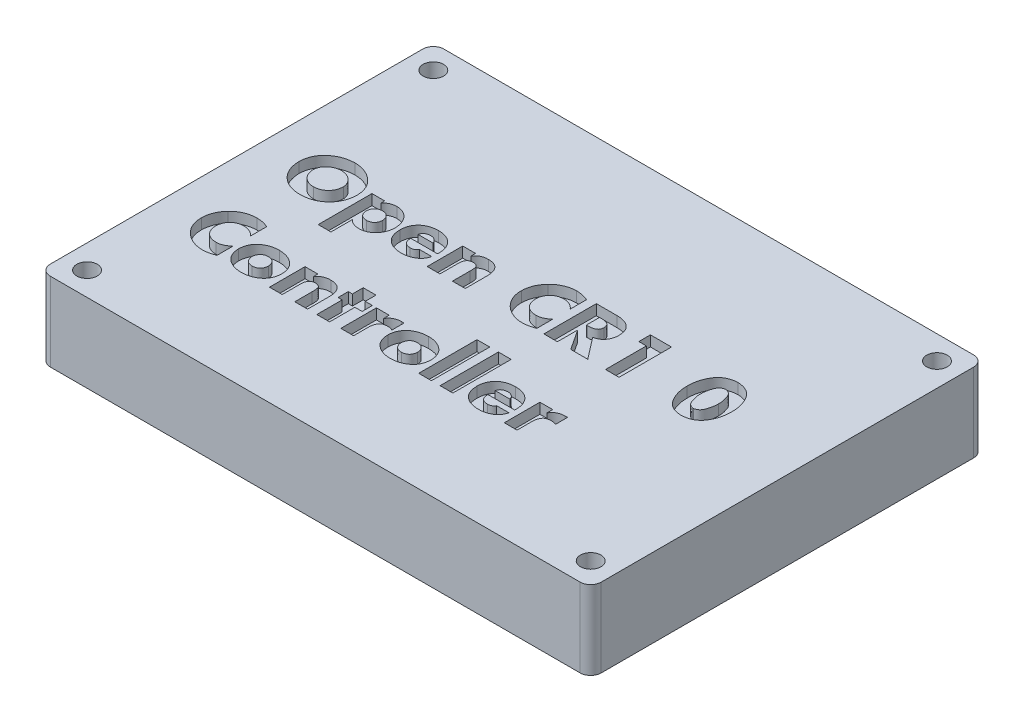
from build123d import *

# Parameters (mm, degrees)
SKETCH1_W              = 105
SKETCH1_H              = 75
BOSS_EXTRUDE1_DEPTH    = 15
M3_5_CLEARANCE_HOLE1_D = 3.9
SKETCH5_W              = 2.434314097
SKETCH5_H              = 11.112828439
CUT_EXTRUDE1_DEPTH     = 2
FILLET37_R             = 2


with BuildPart() as part:
    # Sketch1 → Boss-Extrude1 (new body)
    with BuildSketch(Plane(origin=(0, 0, 0), x_dir=(1, 0, 0), z_dir=(0, 1, 0))):
        Rectangle(SKETCH1_W, SKETCH1_H)
    extrude(amount=BOSS_EXTRUDE1_DEPTH)

    # M3.5 Clearance Hole1 (through all)
    with Locations(Plane(origin=(0, 15, 0), x_dir=(1, 0, 0), z_dir=(0, 1, 0))):
        with Locations((48, 33), (-48, 33), (-48, -33), (48, -33)):
            Hole(M3_5_CLEARANCE_HOLE1_D / 2)

    # Sketch5 → Cut-Extrude1 (cut)
    # profile 1 of 18: a face of its own
    with BuildSketch(Plane(origin=(0, 15, 0), x_dir=(1, 0, 0), z_dir=(0, 1, 0))):
        with BuildLine():
            add(Edge.make_bspline(
                [(-40.185459979, 10.243429334), (-40.370572928, 10.235709066), (-40.735143215, 10.2205044), (-41.270607726, 10.142344985), (-41.786210993, 10.027984963), (-42.281474501, 9.868513562), (-42.756753051, 9.66684576), (-43.212279103, 9.422838832), (-43.646948914, 9.134928108), (-44.057131478, 8.808288253), (-44.437719706, 8.451341468), (-44.769194208, 8.059730999), (-45.056167842, 7.644693482), (-45.292500939, 7.201690642), (-45.481040051, 6.733357083), (-45.619644575, 6.239737383), (-45.712778744, 5.720664917), (-45.733360464, 5.364887779), (-45.743851474, 5.183539413)],
                knots=[0, 0, 0, 0, 1.066914355, 2.10123212, 3.113067516, 4.107006638, 5.094636472, 6.08407704, 7.080306196, 8.094452311, 9.102347328, 10.081583564, 11.044964205, 12.004499658, 12.968487536, 13.948131457, 14.954112089, 16, 16, 16, 16], degree=3))
            add(Edge.make_bspline(
                [(-45.743851474, 5.183539413), (-45.735562012, 4.990079582), (-45.719330771, 4.611274183), (-45.639327567, 4.056719894), (-45.511783486, 3.530406752), (-45.339744339, 3.030319645), (-45.120361445, 2.558268431), (-44.854251472, 2.113444052), (-44.541281651, 1.696059665), (-44.184781539, 1.309559015), (-43.791473483, 0.957836368), (-43.364678416, 0.648727567), (-42.906855993, 0.387649721), (-42.420013053, 0.17179125), (-41.903446611, 0.001762764), (-41.357017758, -0.123286739), (-40.78087975, -0.203504354), (-40.3866891, -0.219706268), (-40.185505261, -0.22797527)],
                knots=[0, 0, 0, 0, 1.071176162, 2.097424104, 3.095011841, 4.064376378, 5.019536036, 5.970643985, 6.927982314, 7.901635748, 8.876032584, 9.843501619, 10.812545035, 11.787469732, 12.786075676, 13.817527939, 14.886127542, 16, 16, 16, 16], degree=3))
            add(Edge.make_bspline(
                [(-40.185505261, -0.22797527), (-39.984316099, -0.219744813), (-39.590752718, -0.20364451), (-39.015315272, -0.12306522), (-38.469480947, 0.001721238), (-37.952974725, 0.171878111), (-37.466436209, 0.387124152), (-37.009822392, 0.649248872), (-36.583285477, 0.958400677), (-36.188198608, 1.308885862), (-35.831732759, 1.696142568), (-35.518686718, 2.113425315), (-35.252527786, 2.558261745), (-35.033418199, 3.030365681), (-34.860358294, 3.530081461), (-34.736970293, 4.057227449), (-34.65227138, 4.610973366), (-34.63820463, 4.990021406), (-34.631023035, 5.183539413)],
                knots=[0, 0, 0, 0, 1.114185034, 2.179552935, 3.211294646, 4.210180819, 5.185379101, 6.151601439, 7.119341966, 8.096675446, 9.070602108, 10.028209086, 10.979583935, 11.935011632, 12.904648193, 13.901681209, 14.928730859, 16, 16, 16, 16], degree=3))
            add(Edge.make_bspline(
                [(-34.631023035, 5.183539413), (-34.641529151, 5.364881722), (-34.662140508, 5.720646979), (-34.755060759, 6.239805206), (-34.894381801, 6.732880834), (-35.079941875, 7.202147874), (-35.316939232, 7.644627519), (-35.603703373, 8.059749008), (-35.935235325, 8.451336463), (-36.31580762, 8.808289578), (-36.725994492, 9.134927919), (-37.160663211, 9.422838299), (-37.616189391, 9.66684806), (-38.091468506, 9.868504881), (-38.586729598, 10.028017867), (-39.102342196, 10.142218561), (-39.637081864, 10.220892731), (-40.001043464, 10.234568248), (-40.185505261, 10.241499227)],
                knots=[0, 0, 0, 0, 1.046239959, 2.052559205, 3.032532875, 3.995465432, 4.955323866, 5.919028783, 6.898594631, 7.906828906, 8.921316385, 9.917880873, 10.907654489, 11.89561676, 12.889890443, 13.902066425, 14.936732342, 16, 16, 16, 16], degree=3))
            Line((-40.185505261, 10.241499227), (-40.185459979, 10.243429334))
        make_face()
        with BuildLine():
            add(Edge.make_bspline(
                [(-40.185459979, 7.685467633), (-40.086830157, 7.67976608), (-39.893344647, 7.668581148), (-39.609293101, 7.628480137), (-39.338450641, 7.563472094), (-39.078298934, 7.481724104), (-38.831526036, 7.375044354), (-38.599442095, 7.243920673), (-38.377089791, 7.095091999), (-38.17069236, 6.92419892), (-37.982745637, 6.738441432), (-37.816833535, 6.54206101), (-37.675033605, 6.33633732), (-37.556114396, 6.121284168), (-37.463022439, 5.896294492), (-37.395638991, 5.662276969), (-37.34946075, 5.420314123), (-37.340390149, 5.255227366), (-37.33581438, 5.17194745)],
                knots=[0, 0, 0, 0, 1.130290503, 2.217329709, 3.277353109, 4.314482939, 5.334424864, 6.347286649, 7.361113167, 8.392466533, 9.40864743, 10.38149446, 11.330003386, 12.263418779, 13.188593609, 14.109797397, 15.046465523, 16, 16, 16, 16], degree=3))
            add(Edge.make_bspline(
                [(-37.33581438, 5.17194745), (-37.340303762, 5.069377476), (-37.349097315, 4.868469077), (-37.395083026, 4.575729302), (-37.462027065, 4.297285984), (-37.554764697, 4.033560261), (-37.673270255, 3.785221545), (-37.815596138, 3.551979858), (-37.980012361, 3.3321411), (-38.169459884, 3.130495555), (-38.376366078, 2.947793094), (-38.598757742, 2.789103231), (-38.830777202, 2.649860116), (-39.078194323, 2.538208421), (-39.337336747, 2.448388186), (-39.609633952, 2.386368473), (-39.892983252, 2.341250375), (-40.086792172, 2.333786258), (-40.185505261, 2.329984544)],
                knots=[0, 0, 0, 0, 1.098473526, 2.151629266, 3.166719768, 4.161133007, 5.138791705, 6.10726526, 7.082221388, 8.072538579, 9.064294906, 10.032547535, 10.993926311, 11.956589956, 12.933445969, 13.925202296, 14.943239095, 16, 16, 16, 16], degree=3))
            add(Edge.make_bspline(
                [(-40.185505261, 2.329984544), (-40.284214216, 2.333821702), (-40.478651922, 2.341380166), (-40.762680062, 2.386204786), (-41.035076592, 2.44805647), (-41.293356811, 2.538563546), (-41.540567044, 2.650362453), (-41.773902547, 2.788496959), (-41.996529631, 2.947871175), (-42.203495286, 3.130474445), (-42.392926823, 3.332146656), (-42.557347257, 3.55197839), (-42.699672023, 3.785221941), (-42.818177883, 4.033560152), (-42.910915432, 4.297286014), (-42.977859494, 4.575729293), (-43.023845199, 4.868469079), (-43.032638753, 5.069377477), (-43.037128135, 5.17194745)],
                knots=[0, 0, 0, 0, 1.056348917, 2.080804725, 3.072174406, 4.042133248, 5.00442159, 5.97136375, 6.939238898, 7.930608578, 8.920539684, 9.895115717, 10.863211703, 11.840489251, 12.834514808, 13.849209568, 14.901954725, 16, 16, 16, 16], degree=3))
            add(Edge.make_bspline(
                [(-43.037128135, 5.17194745), (-43.032552366, 5.255227366), (-43.023481764, 5.420314122), (-42.977303527, 5.662276976), (-42.909920063, 5.896294468), (-42.816828169, 6.121284256), (-42.69790872, 6.336336985), (-42.556109709, 6.542062296), (-42.390194028, 6.738436402), (-42.20226138, 6.924218733), (-41.995810504, 7.09501748), (-41.773186942, 7.244507453), (-41.539842028, 7.37455345), (-41.293264024, 7.48137771), (-41.033954226, 7.563831141), (-40.763013855, 7.628520937), (-40.478354124, 7.66894069), (-40.284158315, 7.678621488), (-40.185505261, 7.683539413)],
                knots=[0, 0, 0, 0, 0.95315381, 1.889448002, 2.81028403, 3.735089514, 4.668132271, 5.616262537, 6.588721189, 7.60449641, 8.635438042, 9.648859823, 10.66775563, 11.687290376, 12.716994241, 13.776594461, 14.870491853, 16, 16, 16, 16], degree=3))
            Line((-40.185505261, 7.683539413), (-40.185459979, 7.685467633))
        make_face(mode=Mode.SUBTRACT)
    # profile 2 of 18: a face of its own
    with BuildSketch(Plane(origin=(0, 15, 0), x_dir=(1, 0, 0), z_dir=(0, 1, 0))):
        with BuildLine():
            Line((-31.054902478, 6.792888376), (-33.489216575, 6.792888376))
            Line((-33.489216575, 6.792888376), (-33.489216575, -3.454404946))
            Line((-33.489216575, -3.454404946), (-31.054902478, -3.454404946))
            Line((-31.054902478, -3.454404946), (-31.054902478, 0.631969517))
            add(Edge.make_bspline(
                [(-31.054902478, 0.631969517), (-30.987873099, 0.560324968), (-30.854907098, 0.418203868), (-30.622696024, 0.241236644), (-30.374820122, 0.088707322), (-30.10808152, -0.031996722), (-29.828998367, -0.123693538), (-29.544212917, -0.192046613), (-29.2528083, -0.23138206), (-29.057335124, -0.236821971), (-28.958689186, -0.239567233)],
                knots=[0, 0, 0, 0, 1.005082862, 1.993780199, 2.984242437, 3.986645382, 4.989636189, 5.99456233, 6.987951778, 8, 8, 8, 8], degree=3))
            add(Edge.make_bspline(
                [(-28.958689186, -0.239567233), (-28.835463596, -0.233589395), (-28.594883177, -0.221918516), (-28.244226908, -0.164397395), (-27.912120949, -0.077742837), (-27.598174075, 0.039691485), (-27.304041847, 0.18961602), (-27.029814438, 0.37104461), (-26.7735623, 0.582377813), (-26.539198137, 0.823861053), (-26.327920735, 1.087720743), (-26.14083337, 1.368273655), (-25.984926826, 1.666429647), (-25.851256403, 1.977372476), (-25.752689267, 2.30664148), (-25.675925019, 2.649816934), (-25.629764521, 3.009483702), (-25.620859326, 3.254639199), (-25.616339882, 3.379057187)],
                knots=[0, 0, 0, 0, 1.07691445, 2.102522109, 3.097195217, 4.070953929, 5.024434895, 5.974591301, 6.937566446, 7.920124459, 8.908462463, 9.886695417, 10.860535366, 11.843672907, 12.838330109, 13.857888027, 14.912864434, 16, 16, 16, 16], degree=3))
            add(Edge.make_bspline(
                [(-25.616339882, 3.379057187), (-25.620570096, 3.503516982), (-25.628886553, 3.748200726), (-25.679102725, 4.107351148), (-25.753777468, 4.451881488), (-25.855816024, 4.78221401), (-25.98862747, 5.096539897), (-26.146960002, 5.396962231), (-26.334032183, 5.682688898), (-26.546234523, 5.951560374), (-26.783961603, 6.19661009), (-27.040056235, 6.414458647), (-27.318562691, 6.5974552), (-27.614023163, 6.75093634), (-27.930877267, 6.870561535), (-28.264905321, 6.962328981), (-28.619538046, 7.017767393), (-28.86190964, 7.031326262), (-28.9857371, 7.038253478)],
                knots=[0, 0, 0, 0, 1.078073293, 2.119455587, 3.135962978, 4.129307889, 5.109391313, 6.087583741, 7.066984285, 8.063644317, 9.049899711, 10.019849874, 10.969815296, 11.930367885, 12.897989272, 13.898031229, 14.926105778, 16, 16, 16, 16], degree=3))
            add(Edge.make_bspline(
                [(-28.9857371, 7.038253478), (-29.085760807, 7.036208697), (-29.284349622, 7.032148953), (-29.577993206, 6.982470831), (-29.865175064, 6.908056637), (-30.142302461, 6.802232304), (-30.405169012, 6.666711521), (-30.641408723, 6.492655054), (-30.854494876, 6.28839092), (-30.970848196, 6.129538683), (-31.029786559, 6.049072643)],
                knots=[0, 0, 0, 0, 1.014062275, 2.013336964, 3.013637032, 4.021085534, 5.017984993, 6.004958594, 6.989418824, 8, 8, 8, 8], degree=3))
            Line((-31.029786559, 6.049072643), (-31.054902478, 6.04965375))
            Line((-31.054902478, 6.04965375), (-31.054902478, 6.792888376))
        make_face()
        with BuildLine():
            add(Edge.make_bspline(
                [(-29.607833449, 4.953630262), (-29.547262259, 4.949747687), (-29.429617551, 4.942206735), (-29.258349919, 4.920858504), (-29.099256254, 4.880527521), (-28.948730852, 4.831688823), (-28.81023284, 4.765103212), (-28.681115411, 4.688097169), (-28.564269084, 4.595933543), (-28.458523156, 4.491844514), (-28.363992184, 4.377503728), (-28.280605712, 4.256216265), (-28.211242778, 4.127539196), (-28.151938011, 3.993673895), (-28.108568778, 3.852009004), (-28.074993893, 3.704919517), (-28.05581663, 3.550854866), (-28.052397877, 3.446082901), (-28.050652092, 3.392581144)],
                knots=[0, 0, 0, 0, 1.17879404, 2.289518822, 3.345083784, 4.361471533, 5.357261256, 6.322423568, 7.275600885, 8.239547066, 9.198694834, 10.152610254, 11.092818568, 12.033775158, 12.990964148, 13.964918075, 14.960786327, 16, 16, 16, 16], degree=3))
            add(Edge.make_bspline(
                [(-28.050652092, 3.392581144), (-28.052406953, 3.337793981), (-28.055844926, 3.230459657), (-28.074836083, 3.073158489), (-28.108298615, 2.924079493), (-28.151916774, 2.781802466), (-28.21140783, 2.648080324), (-28.279465368, 2.519776955), (-28.364846429, 2.401773981), (-28.457823675, 2.289309782), (-28.565025641, 2.189228039), (-28.681172005, 2.09900156), (-28.809859082, 2.02348437), (-28.949359323, 1.961733539), (-29.099241589, 1.913953771), (-29.258655461, 1.876713854), (-29.429437209, 1.853425345), (-29.547230352, 1.849173708), (-29.607839109, 1.84698609)],
                knots=[0, 0, 0, 0, 1.065420712, 2.087281133, 3.074576776, 4.03286587, 4.974903907, 5.916192809, 6.850628588, 7.801280481, 8.748959516, 9.695562723, 10.655404629, 11.641906051, 12.655525839, 13.709407358, 14.821408703, 16, 16, 16, 16], degree=3))
            add(Edge.make_bspline(
                [(-29.607839109, 1.84698609), (-29.668450857, 1.849158985), (-29.786249811, 1.853382007), (-29.957613457, 1.87695803), (-30.117768262, 1.913708159), (-30.267791702, 1.961322599), (-30.406298104, 2.023913564), (-30.534704051, 2.099561131), (-30.652449324, 2.188567229), (-30.759722139, 2.289392905), (-30.85278073, 2.401752108), (-30.9381403, 2.519782821), (-31.006203603, 2.648078747), (-31.065693104, 2.781802897), (-31.10931169, 2.924079373), (-31.142774103, 3.073158523), (-31.161765293, 3.230459648), (-31.165203261, 3.337793978), (-31.16695812, 3.392581144)],
                knots=[0, 0, 0, 0, 1.177800723, 2.289056161, 3.354423679, 4.367363551, 5.341782792, 6.300980856, 7.256909103, 8.203952454, 9.15396667, 10.087775649, 11.028433154, 11.969839292, 12.927485585, 13.914118971, 14.93529395, 16, 16, 16, 16], degree=3))
            add(Edge.make_bspline(
                [(-31.16695812, 3.392581144), (-31.165212337, 3.446082904), (-31.161793588, 3.550854874), (-31.142616294, 3.704919485), (-31.109041526, 3.852009121), (-31.065671866, 3.99367347), (-31.006368664, 4.127540753), (-30.936999883, 4.256210419), (-30.85363558, 4.377525953), (-30.759021041, 4.491760927), (-30.653225631, 4.596604442), (-30.534751327, 4.687537954), (-30.405906437, 4.764665199), (-30.268438057, 4.832102098), (-30.117758301, 4.880811016), (-29.957906405, 4.920490213), (-29.786146083, 4.942731046), (-29.66842766, 4.94865246), (-29.607839109, 4.951700155)],
                knots=[0, 0, 0, 0, 1.038570363, 2.033822138, 3.007173154, 3.96376961, 4.904143715, 5.843770008, 6.797094921, 7.755648943, 8.718998407, 9.681455618, 10.646020462, 11.629906577, 12.645665147, 13.712723228, 14.822760432, 16, 16, 16, 16], degree=3))
            Line((-29.607839109, 4.951700155), (-29.607833449, 4.953630262))
        make_face(mode=Mode.SUBTRACT)
    # profile 3 of 18: a face of its own
    with BuildSketch(Plane(origin=(0, 15, 0), x_dir=(1, 0, 0), z_dir=(0, 1, 0))):
        with BuildLine():
            add(Edge.make_bspline(
                [(-17.284929738, 3.342249309), (-17.288679496, 3.478950097), (-17.2960075, 3.746099074), (-17.344939316, 4.13670297), (-17.42452081, 4.505355998), (-17.528797478, 4.854295208), (-17.670036731, 5.178290154), (-17.83803231, 5.482271301), (-18.038825429, 5.763065351), (-18.266105101, 6.023436239), (-18.524242503, 6.254317001), (-18.806066766, 6.460787429), (-19.117202041, 6.630761463), (-19.451253597, 6.776399258), (-19.812480287, 6.884115479), (-20.197994023, 6.966297796), (-20.609305554, 7.01587273), (-20.892484588, 7.02556276), (-21.037514534, 7.030525502)],
                knots=[0, 0, 0, 0, 1.102782696, 2.155124876, 3.170070917, 4.142976072, 5.087828941, 6.01584772, 6.939916815, 7.867571937, 8.798262867, 9.72838806, 10.679618793, 11.652440709, 12.663162538, 13.714760587, 14.829616211, 16, 16, 16, 16], degree=3))
            add(Edge.make_bspline(
                [(-21.037514534, 7.030525502), (-21.176087328, 7.026038891), (-21.446906964, 7.017270486), (-21.842720682, 6.971522929), (-22.216488191, 6.893353418), (-22.571123426, 6.790193614), (-22.90354795, 6.653735366), (-23.217577589, 6.491976463), (-23.507629792, 6.296997382), (-23.777300417, 6.076962117), (-24.02034555, 5.830746287), (-24.232234627, 5.560028346), (-24.413544702, 5.268112225), (-24.562599664, 4.952976081), (-24.680518448, 4.616248891), (-24.764933665, 4.257443242), (-24.820039952, 3.877213099), (-24.830467649, 3.615595488), (-24.83581438, 3.481452859)],
                knots=[0, 0, 0, 0, 1.137689445, 2.223442528, 3.265294305, 4.268773578, 5.250351616, 6.210241881, 7.163164631, 8.11340075, 9.062798496, 9.996498222, 10.929404615, 11.877521311, 12.85214354, 13.85216426, 14.89871201, 16, 16, 16, 16], degree=3))
            add(Edge.make_bspline(
                [(-24.83581438, 3.481452859), (-24.830262307, 3.332451835), (-24.819473776, 3.042919969), (-24.757030402, 2.623755128), (-24.668802082, 2.231458431), (-24.542556948, 1.868120352), (-24.383359321, 1.533023693), (-24.191236624, 1.224827705), (-23.963988495, 0.945878179), (-23.705755237, 0.695881698), (-23.420767453, 0.47623875), (-23.115084742, 0.283841768), (-22.787806974, 0.124002427), (-22.442778805, -0.011107938), (-22.076045024, -0.11233856), (-21.690298899, -0.185380756), (-21.284600839, -0.230809511), (-21.007367091, -0.236603641), (-20.865567084, -0.239567233)],
                knots=[0, 0, 0, 0, 1.163066474, 2.260016722, 3.302588064, 4.297800306, 5.255671425, 6.192968005, 7.125669966, 8.057084086, 8.992221305, 9.929517885, 10.871493985, 11.831170557, 12.81791666, 13.836358061, 14.893336609, 16, 16, 16, 16], degree=3))
            add(Edge.make_bspline(
                [(-20.865567084, -0.239567233), (-20.766344722, -0.238194379), (-20.569505936, -0.235470891), (-20.27765437, -0.21030078), (-19.993164521, -0.165539569), (-19.715673037, -0.103533604), (-19.445216858, -0.024341241), (-19.181315771, 0.071910313), (-18.926269524, 0.18884746), (-18.679045549, 0.320889155), (-18.445359122, 0.472040873), (-18.231647252, 0.645548743), (-18.036680438, 0.83773321), (-17.863374078, 1.05073008), (-17.708636371, 1.282323493), (-17.5784424, 1.535238253), (-17.464471395, 1.806060573), (-17.408664525, 1.997042232), (-17.380250237, 2.094281298)],
                knots=[0, 0, 0, 0, 1.049201029, 2.081420473, 3.094773408, 4.092790319, 5.086335346, 6.073205057, 7.060732588, 8.051097814, 9.035284723, 9.998968218, 10.957342387, 11.925324256, 12.898133995, 13.897335386, 14.929420008, 16, 16, 16, 16], degree=3))
            Line((-17.380250237, 2.094281298), (-19.715385507, 2.094281298))
            add(Edge.make_bspline(
                [(-19.715385507, 2.094281298), (-19.749219752, 2.043830935), (-19.814837079, 1.945988702), (-19.930763327, 1.816150893), (-20.058555015, 1.707106705), (-20.200007289, 1.619017857), (-20.352823397, 1.551212565), (-20.518099346, 1.504991507), (-20.694571316, 1.476920434), (-20.816515001, 1.476340746), (-20.879091041, 1.476043277)],
                knots=[0, 0, 0, 0, 1.051326352, 2.038917281, 3.004525721, 3.951721342, 4.915652817, 5.890241468, 6.917366374, 8, 8, 8, 8], degree=3))
            add(Edge.make_bspline(
                [(-20.879091041, 1.476043277), (-20.940345429, 1.478300641), (-21.058703259, 1.482662397), (-21.230393162, 1.504786047), (-21.390653019, 1.535921783), (-21.538958719, 1.583659942), (-21.676149361, 1.640465777), (-21.801884697, 1.711253548), (-21.915750554, 1.793814787), (-22.017798575, 1.889824395), (-22.106619396, 1.998757207), (-22.184255097, 2.119347283), (-22.250517344, 2.252065213), (-22.304066186, 2.397348035), (-22.346585433, 2.555108437), (-22.377550783, 2.725007693), (-22.393937219, 2.907339311), (-22.397656511, 3.03255805), (-22.399570176, 3.09698609)],
                knots=[0, 0, 0, 0, 1.158879783, 2.239227257, 3.271313107, 4.242201573, 5.181154615, 6.075672522, 6.965032745, 7.835418892, 8.718247618, 9.617068503, 10.543211434, 11.51844633, 12.540925798, 13.630505717, 14.780838457, 16, 16, 16, 16], degree=3))
            Line((-22.399570176, 3.09698609), (-17.284929738, 3.098916197))
            Line((-17.284929738, 3.098916197), (-17.284929738, 3.342249309))
        make_face()
        with BuildLine():
            add(Edge.make_bspline(
                [(-22.359507718, 4.443585781), (-22.337229449, 4.522655971), (-22.294027907, 4.675987198), (-22.18026882, 4.883061919), (-22.033669547, 5.060827438), (-21.851284356, 5.203168322), (-21.645113539, 5.315249959), (-21.419156271, 5.396753697), (-21.17419924, 5.445851414), (-21.004900657, 5.452517999), (-20.917730917, 5.455950541)],
                knots=[0, 0, 0, 0, 1.028318465, 1.99409322, 2.941113281, 3.901834164, 4.878575192, 5.875839621, 6.906296173, 8, 8, 8, 8], degree=3))
            add(Edge.make_bspline(
                [(-20.917730917, 5.455950541), (-20.835662082, 5.452006936), (-20.675611013, 5.444316098), (-20.443152491, 5.390702194), (-20.227661464, 5.302359693), (-20.027587276, 5.185878401), (-19.853986362, 5.036913458), (-19.710276421, 4.863504713), (-19.602381618, 4.66381472), (-19.562513072, 4.518037463), (-19.542151319, 4.443585781)],
                knots=[0, 0, 0, 0, 1.066545448, 2.07998246, 3.082746843, 4.084951881, 5.076575458, 6.040274496, 6.999124657, 8, 8, 8, 8], degree=3))
            Line((-19.542151319, 4.443585781), (-22.359507718, 4.443585781))
        make_face(mode=Mode.SUBTRACT)
    # profile 4 of 18: a face of its own
    with BuildSketch(Plane(origin=(0, 15, 0), x_dir=(1, 0, 0), z_dir=(0, 1, 0))):
        with BuildLine():
            Line((-13.744237873, 6.789748886), (-16.17855197, 6.789748886))
            Line((-16.17855197, 6.789748886), (-16.17855197, 0.007726089))
            Line((-16.17855197, 0.007726089), (-13.744237873, 0.007726089))
            Line((-13.744237873, 0.007726089), (-13.744237873, 3.512253444))
            add(Edge.make_bspline(
                [(-13.744237873, 3.512253444), (-13.743157814, 3.616807621), (-13.741058391, 3.820040526), (-13.692173924, 4.112115967), (-13.608900399, 4.380225297), (-13.508257845, 4.583374207), (-13.405110633, 4.72723338), (-13.3137033, 4.821866683), (-13.205014845, 4.898711878), (-13.084823038, 4.965176996), (-12.949622169, 5.017314762), (-12.800610689, 5.055905397), (-12.636532201, 5.078198395), (-12.522635902, 5.083946484), (-12.463325972, 5.086939722)],
                knots=[0, 0, 0, 0, 1.619596615, 3.148179619, 4.572700448, 5.961771063, 6.640968167, 7.31189108, 7.991088184, 8.697283705, 9.437274179, 10.231799066, 11.079233691, 12, 12, 12, 12], degree=3))
            add(Edge.make_bspline(
                [(-12.463325972, 5.086939722), (-12.394863105, 5.081364174), (-12.264031933, 5.070709415), (-12.08064443, 5.031964408), (-11.918017434, 4.978362619), (-11.778650001, 4.905602995), (-11.661189754, 4.814836021), (-11.566633041, 4.707051516), (-11.495306569, 4.580754621), (-11.438382153, 4.390981005), (-11.393249186, 4.148901076), (-11.354152295, 3.861271821), (-11.341848171, 3.580513446), (-11.352817444, 3.396408641), (-11.358225508, 3.305641422)],
                knots=[0, 0, 0, 0, 1.013838254, 1.937424677, 2.761750667, 3.536262595, 4.247991354, 4.942471318, 5.641044329, 6.372093875, 7.857224403, 9.276766285, 10.657393262, 12, 12, 12, 12], degree=3))
            Line((-11.358225508, 3.305641422), (-11.356297287, 0.007726089))
            Line((-11.356297287, 0.007726089), (-8.921983191, 0.007726089))
            Line((-8.921983191, 0.007726089), (-8.921983191, 4.191351158))
            add(Edge.make_bspline(
                [(-8.921983191, 4.191351158), (-8.9230578, 4.29482038), (-8.925160402, 4.497270239), (-8.953473439, 4.792471541), (-8.996257355, 5.07326595), (-9.062762102, 5.337110653), (-9.144846864, 5.586912152), (-9.250038663, 5.819470708), (-9.374040007, 6.036992294), (-9.516939753, 6.238764091), (-9.680718245, 6.423083625), (-9.873471719, 6.579560448), (-10.086502341, 6.71636583), (-10.3249512, 6.826067754), (-10.586038218, 6.913171153), (-10.870845652, 6.976458038), (-11.180151828, 7.014405723), (-11.394184166, 7.022479265), (-11.505057038, 7.026661515)],
                knots=[0, 0, 0, 0, 1.133075745, 2.216997674, 3.245792317, 4.241645155, 5.194276936, 6.122644138, 7.03270966, 7.93320859, 8.82730076, 9.724283021, 10.644140325, 11.594156132, 12.59140743, 13.65430104, 14.784882777, 16, 16, 16, 16], degree=3))
            add(Edge.make_bspline(
                [(-11.505057038, 7.026661515), (-11.620482624, 7.025290446), (-11.845189748, 7.022621289), (-12.171814371, 6.977197461), (-12.476874476, 6.900729338), (-12.762242958, 6.789604803), (-13.029372241, 6.638801371), (-13.278754527, 6.442363483), (-13.512217947, 6.200284353), (-13.648522249, 6.014121389), (-13.719121953, 5.917697063)],
                knots=[0, 0, 0, 0, 1.066732545, 2.076683433, 3.041656195, 3.969616389, 4.900458365, 5.867909398, 6.895669729, 8, 8, 8, 8], degree=3))
            Line((-13.719121953, 5.917697063), (-13.744237873, 5.918231003))
            Line((-13.744237873, 5.918231003), (-13.744237873, 6.789748886))
        make_face()
    # profile 5 of 18: a face of its own
    with BuildSketch(Plane(origin=(0, 15, 0), x_dir=(1, 0, 0), z_dir=(0, 1, 0))):
        with BuildLine():
            add(Edge.make_bspline(
                [(4.478746665, 9.731932084), (4.38311298, 9.772260082), (4.192680919, 9.852563833), (3.899947301, 9.951151015), (3.605929691, 10.039508807), (3.307884973, 10.110722599), (3.006748868, 10.166969705), (2.702271299, 10.206657519), (2.395544048, 10.235767741), (2.189627057, 10.239586888), (2.086519469, 10.241499227)],
                knots=[0, 0, 0, 0, 1.011298507, 2.013763841, 3.008812463, 4.002989556, 4.998988067, 5.993264236, 6.995179154, 8, 8, 8, 8], degree=3))
            add(Edge.make_bspline(
                [(2.086519469, 10.241499227), (1.908433283, 10.235798086), (1.554196789, 10.224457779), (1.028848337, 10.136944859), (0.512598829, 10.00258258), (0.009678859, 9.812409995), (-0.472874083, 9.576187039), (-0.929135273, 9.295960622), (-1.354128983, 8.972284955), (-1.609212537, 8.723723541), (-1.736896296, 8.599304482)],
                knots=[0, 0, 0, 0, 1.000306157, 1.989738525, 2.98515565, 3.994092039, 5.005653633, 5.999991288, 6.998882416, 8, 8, 8, 8], degree=3))
            add(Edge.make_bspline(
                [(-1.736896296, 8.599304482), (-1.852278516, 8.472720441), (-2.080565769, 8.222270044), (-2.374143301, 7.809811309), (-2.628595574, 7.379384686), (-2.837609894, 6.927402977), (-3.001915731, 6.460259235), (-3.119779003, 5.980875569), (-3.194102199, 5.491104876), (-3.204060997, 5.160616148), (-3.209075585, 4.994204019)],
                knots=[0, 0, 0, 0, 1.029459571, 2.036817256, 3.03868562, 4.033512114, 5.02710096, 6.012660506, 6.999308088, 8, 8, 8, 8], degree=3))
            add(Edge.make_bspline(
                [(-3.209075585, 4.994204019), (-3.206485801, 4.81428242), (-3.201386354, 4.460005547), (-3.12746965, 3.939285322), (-3.004431783, 3.439614636), (-2.826570788, 2.96145118), (-2.599429396, 2.502517866), (-2.31982112, 2.064616646), (-1.987575536, 1.647988242), (-1.733054964, 1.39443178), (-1.603588723, 1.265455951)],
                knots=[0, 0, 0, 0, 1.031241248, 2.030578469, 3.008886568, 3.977748828, 4.950742656, 5.940607272, 6.952454673, 8, 8, 8, 8], degree=3))
            add(Edge.make_bspline(
                [(-1.603588723, 1.265455951), (-1.471983836, 1.149131676), (-1.210549876, 0.918052749), (-0.778906649, 0.625840137), (-0.33231387, 0.363935048), (0.140606466, 0.154085463), (0.628110331, -0.018462059), (1.13162363, -0.136483678), (1.645580694, -0.213565937), (1.99286236, -0.223150815), (2.167663209, -0.22797527)],
                knots=[0, 0, 0, 0, 1.014469081, 2.015249407, 3.007683956, 4.004202759, 5.001535015, 5.993096172, 6.989844478, 8, 8, 8, 8], degree=3))
            add(Edge.make_bspline(
                [(2.167663209, -0.22797527), (2.266243169, -0.225854893), (2.460497606, -0.221676632), (2.748360542, -0.196429917), (3.028047298, -0.153352842), (3.304427351, -0.096228309), (3.583004135, -0.025375746), (3.8698945, 0.057438415), (4.1710861, 0.142755511), (4.374189279, 0.20803038), (4.478327815, 0.241499227)],
                knots=[0, 0, 0, 0, 0.999090017, 1.968733513, 2.925908886, 3.865409875, 4.82782206, 5.838168053, 6.891548543, 8, 8, 8, 8], degree=3))
            Line((4.478327815, 0.241499227), (4.478746665, 3.364808733))
            add(Edge.make_bspline(
                [(4.478746665, 3.364808733), (4.406210311, 3.286703203), (4.26234902, 3.131796572), (4.016880675, 2.929529674), (3.751129956, 2.753404215), (3.466635309, 2.603110867), (3.167375234, 2.483529786), (2.858759017, 2.395773624), (2.542369042, 2.342392638), (2.328860859, 2.334129547), (2.221759036, 2.329984544)],
                knots=[0, 0, 0, 0, 0.999623348, 1.982552158, 2.97673614, 3.988010647, 4.997132985, 5.996010345, 6.99474137, 8, 8, 8, 8], degree=3))
            add(Edge.make_bspline(
                [(2.221759036, 2.329984544), (2.121177369, 2.333435527), (1.92379294, 2.340207838), (1.635938287, 2.379012059), (1.364847129, 2.441400548), (1.108745956, 2.522216521), (0.868325034, 2.626721925), (0.643631434, 2.754428103), (0.435540405, 2.904569744), (0.244046894, 3.074328476), (0.072720368, 3.263105168), (-0.076736569, 3.467515281), (-0.205351907, 3.684462416), (-0.309867075, 3.916704159), (-0.393442562, 4.162421275), (-0.452183148, 4.422841391), (-0.492521623, 4.696749502), (-0.499024802, 4.884575964), (-0.502352247, 4.980680062)],
                knots=[0, 0, 0, 0, 1.132315926, 2.222090147, 3.263110338, 4.260329573, 5.240729565, 6.208180716, 7.163772923, 8.1239457, 9.083571059, 10.02743369, 10.969791979, 11.917072249, 12.889021055, 13.886029495, 14.91835673, 16, 16, 16, 16], degree=3))
            add(Edge.make_bspline(
                [(-0.502352247, 4.980680062), (-0.498722802, 5.075453422), (-0.491585778, 5.261817923), (-0.455004402, 5.534917061), (-0.394221991, 5.795142926), (-0.314598563, 6.043229451), (-0.207812416, 6.277029357), (-0.082914331, 6.499537735), (0.064769755, 6.70973451), (0.234816603, 6.90416497), (0.423053523, 7.081792196), (0.628759776, 7.236763141), (0.849544884, 7.369443976), (1.085369723, 7.480327918), (1.338747968, 7.564587673), (1.605803982, 7.627630596), (1.888026642, 7.672396171), (2.081834699, 7.679762954), (2.181187166, 7.683539413)],
                knots=[0, 0, 0, 0, 1.068114139, 2.100364062, 3.098257761, 4.07565821, 5.030391217, 5.988811209, 6.946956543, 7.918875113, 8.894118894, 9.857633258, 10.814486642, 11.791483078, 12.787238064, 13.816704983, 14.880770228, 16, 16, 16, 16], degree=3))
            add(Edge.make_bspline(
                [(2.181187166, 7.683539413), (2.293419248, 7.680087899), (2.515156978, 7.673268719), (2.843353214, 7.622063028), (3.160368978, 7.53441686), (3.466323874, 7.414658622), (3.755899478, 7.263415592), (4.022330059, 7.077570626), (4.267724581, 6.862730589), (4.407633765, 6.695687338), (4.478327815, 6.611282844)],
                knots=[0, 0, 0, 0, 1.026268296, 2.02760563, 3.029306706, 4.029048946, 5.027627937, 6.009617821, 6.9942892, 8, 8, 8, 8], degree=3))
            Line((4.478327815, 6.611282844), (4.478746665, 9.731932084))
        make_face()
    # profile 6 of 18: a face of its own
    with BuildSketch(Plane(origin=(0, 15, 0), x_dir=(1, 0, 0), z_dir=(0, 1, 0))):
        with BuildLine():
            add(Edge.make_bspline(
                [(11.282091203, 4.088095145), (11.368347973, 4.107308605), (11.537934123, 4.145083458), (11.782105802, 4.224766722), (12.011114318, 4.322524636), (12.221957504, 4.442020665), (12.419479648, 4.575087088), (12.599182949, 4.728981331), (12.764498086, 4.898985956), (12.91069086, 5.08755271), (13.041062177, 5.287623619), (13.156638375, 5.49675017), (13.250536931, 5.716880156), (13.330243699, 5.944514529), (13.392084348, 6.181636299), (13.436995849, 6.427587847), (13.461419342, 6.682916884), (13.465718066, 6.85595495), (13.467895049, 6.943585781)],
                knots=[0, 0, 0, 0, 1.079785332, 2.122924831, 3.134942208, 4.118290511, 5.081258967, 6.041907635, 7.005101327, 7.975219486, 8.953449276, 9.92228886, 10.891927751, 11.87537059, 12.86831521, 13.884396992, 14.928605403, 16, 16, 16, 16], degree=3))
            add(Edge.make_bspline(
                [(13.467895049, 6.943585781), (13.462226815, 7.071897644), (13.451246982, 7.320448271), (13.401416629, 7.680387454), (13.320687253, 8.01385351), (13.210614878, 8.321236238), (13.071552913, 8.602596211), (12.899862022, 8.854792575), (12.701041604, 9.082529821), (12.471574738, 9.280409335), (12.220213244, 9.45414384), (11.949350688, 9.602694365), (11.663173014, 9.731494784), (11.358001207, 9.83317565), (11.036230576, 9.912479401), (10.696443076, 9.967969325), (10.339389163, 10.001323355), (10.095351525, 10.004286114), (9.970986239, 10.005795981)],
                knots=[0, 0, 0, 0, 1.167449134, 2.261444928, 3.298260797, 4.281867209, 5.224655577, 6.143945113, 7.048493777, 7.965710673, 8.891616295, 9.822139928, 10.771091562, 11.741447722, 12.742745196, 13.781510621, 14.869424117, 16, 16, 16, 16], degree=3))
            Line((9.970986239, 10.005795981), (6.066424847, 10.007726089))
            Line((6.066424847, 10.007726089), (6.066424847, 0.007726089))
            Line((6.066424847, 0.007726089), (8.647570474, 0.007726089))
            Line((8.647570474, 0.007726089), (8.647570474, 3.837205748))
            Line((8.647570474, 3.837205748), (8.674893847, 3.837205748))
            Line((8.674893847, 3.837205748), (11.189285692, 0.007726089))
            Line((11.189285692, 0.007726089), (14.431324141, 0.007726089))
            Line((14.431324141, 0.007726089), (11.282091203, 4.088095145))
        make_face()
        with BuildLine():
            Line((8.647570474, 8.044818483), (8.907142522, 8.044818483))
            add(Edge.make_bspline(
                [(8.907142522, 8.044818483), (9.019691221, 8.045098016), (9.239899692, 8.04564494), (9.563983837, 8.008944349), (9.871457953, 7.936569029), (10.116085632, 7.852317457), (10.296569647, 7.761198156), (10.415747632, 7.673476793), (10.517611974, 7.567640472), (10.601631835, 7.444099203), (10.666980602, 7.302761515), (10.717418508, 7.145201073), (10.749758127, 6.969864624), (10.75853544, 6.847116251), (10.763103704, 6.783230294)],
                knots=[0, 0, 0, 0, 1.581936225, 3.095155776, 4.573638238, 6.017485226, 6.722334664, 7.408850218, 8.08779699, 8.778600331, 9.499728066, 10.270182319, 11.099694309, 12, 12, 12, 12], degree=3))
            add(Edge.make_bspline(
                [(10.763103704, 6.783230294), (10.75853544, 6.719344336), (10.749758127, 6.596595963), (10.717418508, 6.421259514), (10.666980602, 6.263699073), (10.601631835, 6.122361384), (10.517611974, 5.998820116), (10.415747632, 5.892983793), (10.296569647, 5.805262438), (10.116085634, 5.714143091), (9.871457939, 5.629891886), (9.56398389, 5.557514998), (9.239672005, 5.520794722), (9.019234877, 5.521352809), (8.906457645, 5.521638331)],
                knots=[0, 0, 0, 0, 0.900064898, 1.729355029, 2.499603218, 3.220538083, 3.911156663, 4.589921847, 5.276253788, 5.980914708, 7.42437553, 8.902462561, 10.415277391, 12, 12, 12, 12], degree=3))
            Line((8.906457645, 5.521638331), (8.647570474, 5.523247697))
            Line((8.647570474, 5.523247697), (8.647570474, 8.044818483))
        make_face(mode=Mode.SUBTRACT)
    # profile 7 of 18: a face of its own
    with BuildSketch(Plane(origin=(0, 15, 0), x_dir=(1, 0, 0), z_dir=(0, 1, 0))):
        Polygon((17.812947258, 7.797523274), (17.812947258, 0.007726089), (20.394090998, 0.007726089), (20.394090998, 10.007726089), (16.370698779, 10.007726089), (16.370698779, 7.797523274), align=None)
    # profile 8 of 18: a face of its own
    with BuildSketch(Plane(origin=(0, 15, 0), x_dir=(1, 0, 0), z_dir=(0, 1, 0))):
        with BuildLine():
            add(Edge.make_bspline(
                [(32.581191015, 10.490724543), (32.48962814, 10.48526814), (32.310010459, 10.474564388), (32.04594995, 10.441961196), (31.790715468, 10.403349376), (31.54475314, 10.347852144), (31.307249927, 10.283962982), (31.081129694, 10.203065577), (30.862816868, 10.11496299), (30.654850003, 10.012002492), (30.454862526, 9.899027401), (30.267207647, 9.769616259), (30.08707294, 9.631215844), (29.916876034, 9.479295403), (29.754283966, 9.317931178), (29.602745241, 9.142759254), (29.462138142, 8.954631798), (29.285467403, 8.690254428), (29.08748523, 8.343985913), (28.880100743, 7.913790276), (28.703887803, 7.471077441), (28.560348525, 7.015241769), (28.450076535, 6.54639115), (28.373329648, 6.064707513), (28.327865804, 5.570187067), (28.323348553, 5.236443005), (28.321063518, 5.067619784)],
                knots=[0, 0, 0, 0, 0.855027023, 1.677295199, 2.479880488, 3.260788735, 4.027061811, 4.771496529, 5.498533791, 6.220919201, 6.933682257, 7.638177058, 8.344409841, 9.050514977, 9.763834267, 10.478970934, 11.207939768, 11.952374486, 13.442708337, 14.922505028, 16.402167703, 17.881574493, 19.374470636, 20.888804579, 22.426213098, 24, 24, 24, 24], degree=3))
            add(Edge.make_bspline(
                [(28.321063518, 5.067619784), (28.323356423, 4.898797425), (28.327889231, 4.56505507), (28.373180907, 4.071155937), (28.450186862, 3.590138752), (28.560758798, 3.122249756), (28.701931585, 2.666182092), (28.875855944, 2.222968006), (29.083746271, 1.793563518), (29.280668734, 1.447668368), (29.454030051, 1.1813545), (29.597141333, 0.995013524), (29.74840208, 0.819832437), (29.909151315, 0.657222849), (30.079487899, 0.50612769), (30.259665537, 0.366891552), (30.448833005, 0.238739639), (30.649014138, 0.125135161), (30.857478342, 0.021736773), (31.076806449, -0.065436644), (31.303356544, -0.146869466), (31.540900775, -0.210633116), (31.787455543, -0.266431056), (32.044039014, -0.304628848), (32.309274249, -0.337785501), (32.489564271, -0.346962886), (32.581109886, -0.351622875)],
                knots=[0, 0, 0, 0, 1.57346418, 3.110557436, 4.618653696, 6.111243704, 7.588555062, 9.065707834, 10.545201077, 12.032239053, 12.773196623, 13.505641656, 14.220631677, 14.929572325, 15.635532666, 16.341620627, 17.050942461, 17.763559357, 18.485796634, 19.218241666, 19.962523729, 20.728639672, 21.509387785, 22.31773793, 23.145800114, 24, 24, 24, 24], degree=3))
            add(Edge.make_bspline(
                [(32.581109886, -0.351622875), (32.672655494, -0.346962874), (32.852945502, -0.337785463), (33.118180842, -0.304628992), (33.37476393, -0.266430535), (33.621320066, -0.210634974), (33.858859366, -0.146862751), (34.085427196, -0.065460766), (34.304690822, 0.021824774), (34.512889621, 0.124566206), (34.711748704, 0.239346399), (34.900667236, 0.366813239), (35.080787852, 0.506148626), (35.251139701, 0.657217216), (35.411884822, 0.819833962), (35.563146687, 0.995013103), (35.706257667, 1.181354613), (35.87961906, 1.447668303), (36.076541674, 1.793563535), (36.284431186, 2.222968017), (36.458358618, 2.666182033), (36.59951989, 3.122249981), (36.710135388, 3.590137897), (36.786975719, 4.071159192), (36.832901845, 4.565026619), (36.835817475, 4.898793111), (36.837292266, 5.067619784)],
                knots=[0, 0, 0, 0, 0.854390413, 1.682637293, 2.491167739, 3.272089995, 4.038376818, 4.782824891, 5.515433294, 6.237831663, 6.945403304, 7.654883349, 8.361128802, 9.067246605, 9.77634538, 10.491494877, 11.22410328, 11.965226119, 13.452595775, 14.932419014, 16.40990126, 17.887542129, 19.380465054, 20.888897691, 22.426333791, 24, 24, 24, 24], degree=3))
            add(Edge.make_bspline(
                [(36.837292266, 5.067619784), (36.836033664, 5.236464264), (36.833544996, 5.570325085), (36.784412701, 6.064626741), (36.707835683, 6.546105213), (36.60050575, 7.015532741), (36.456236564, 7.471036716), (36.280232169, 7.913802484), (36.072785307, 8.343977762), (35.874837189, 8.690270106), (35.698123093, 8.954605468), (35.557639742, 9.142856384), (35.405946748, 9.317233136), (35.245377857, 9.479975629), (35.074996195, 9.631041303), (34.894819757, 9.770263371), (34.705692792, 9.898501555), (34.50584994, 10.011487359), (34.298552115, 10.115935718), (34.079588892, 10.202569902), (33.853616992, 10.2836855), (33.616903973, 10.348151213), (33.37149434, 10.40333435), (33.116264702, 10.441847667), (32.852310873, 10.47504573), (32.672656977, 10.484153398), (32.581109886, 10.488794436)],
                knots=[0, 0, 0, 0, 1.57406359, 3.112439108, 4.627182624, 6.11911697, 7.598923887, 9.078986757, 10.559183681, 12.049920614, 12.794556674, 13.523722667, 14.239052753, 14.94833059, 15.654626702, 16.361050495, 17.070709698, 17.783665532, 18.500859181, 19.233652581, 19.978288642, 20.738981453, 21.520100907, 22.322903267, 23.145393837, 24, 24, 24, 24], degree=3))
            Line((32.581109886, 10.488794436), (32.581191015, 10.490724543))
        make_face()
        with BuildLine():
            add(Edge.make_bspline(
                [(32.581191015, 8.18005805), (32.660870888, 8.168184669), (32.816398797, 8.145008902), (33.037469509, 8.072156578), (33.239124883, 7.969599931), (33.418632798, 7.833483096), (33.57980555, 7.668822528), (33.718374246, 7.471876261), (33.836753427, 7.244825604), (33.931687371, 6.993196279), (34.008103877, 6.73050521), (34.081973063, 6.472450211), (34.138050912, 6.221016869), (34.188621791, 5.978744547), (34.22258055, 5.743142626), (34.245953114, 5.515634017), (34.258565885, 5.295735809), (34.256946672, 5.151996141), (34.256148526, 5.08114374)],
                knots=[0, 0, 0, 0, 1.000337931, 1.952569195, 2.880236694, 3.8012084, 4.741306243, 5.734644582, 6.784240434, 7.917513872, 9.072730994, 10.186020715, 11.254481159, 12.275362181, 13.262969954, 14.212840951, 15.119070542, 16, 16, 16, 16], degree=3))
            add(Edge.make_bspline(
                [(34.256148526, 5.08114374), (34.256953996, 5.010290452), (34.258588069, 4.866548981), (34.245822501, 4.646024712), (34.222813294, 4.417825411), (34.188123604, 4.180422391), (34.138690063, 3.936629538), (34.081282839, 3.682938377), (34.008597569, 3.422632296), (33.931199222, 3.157059788), (33.837234268, 2.902513748), (33.718326721, 2.673128105), (33.579874735, 2.474189171), (33.418617456, 2.307812189), (33.239789993, 2.169125861), (33.036991807, 2.067689077), (32.816988741, 1.991092911), (32.66092193, 1.969886578), (32.581109886, 1.959041731)],
                knots=[0, 0, 0, 0, 0.876142289, 1.777447224, 2.73008081, 3.7123217, 4.743280271, 5.805934461, 6.928537575, 8.085099152, 9.227087903, 10.278036182, 11.272472911, 12.213178003, 13.133945947, 14.056572292, 15.006137592, 16, 16, 16, 16], degree=3))
            add(Edge.make_bspline(
                [(32.581109886, 1.959041731), (32.500663074, 1.969864304), (32.343957515, 1.990946027), (32.123610203, 2.067098884), (31.921884936, 2.170304659), (31.741868178, 2.307128794), (31.580280481, 2.473710041), (31.44424508, 2.673785768), (31.324623974, 2.902355349), (31.23190029, 3.157526894), (31.150183474, 3.421845772), (31.082616464, 3.683674687), (31.019897275, 3.935992585), (30.975645284, 4.180924546), (30.936603172, 4.417583969), (30.914683342, 4.646060692), (30.901648192, 4.866540481), (30.903316773, 5.010287645), (30.904139253, 5.08114374)],
                knots=[0, 0, 0, 0, 1.001443887, 1.950752543, 2.866056374, 3.792925005, 4.733375847, 5.722973187, 6.77363742, 7.915317519, 9.073894756, 10.194130443, 11.258316215, 12.287487837, 13.270657064, 14.223033177, 15.124094511, 16, 16, 16, 16], degree=3))
            add(Edge.make_bspline(
                [(30.904139253, 5.08114374), (30.903324003, 5.151998975), (30.901670089, 5.295744395), (30.914553152, 5.515597804), (30.936839422, 5.743384154), (30.975143579, 5.978238473), (31.020538252, 6.221657937), (31.081924362, 6.471708126), (31.150683697, 6.73129789), (31.231404556, 6.992727777), (31.325107152, 7.244984307), (31.444192703, 7.471214789), (31.580353277, 7.669306975), (31.741863029, 7.834154937), (31.922535931, 7.968455862), (32.123157785, 8.07261651), (32.344384693, 8.145605274), (32.500739704, 8.167087471), (32.581109886, 8.17812983)],
                knots=[0, 0, 0, 0, 0.880749443, 1.786793849, 2.736470744, 3.725077118, 4.744209504, 5.814280462, 6.925238405, 8.082576089, 9.215617947, 10.264999317, 11.253508415, 12.193414152, 13.120615557, 14.040981224, 14.993017903, 16, 16, 16, 16], degree=3))
            Line((32.581109886, 8.17812983), (32.581191015, 8.18005805))
        make_face(mode=Mode.SUBTRACT)
    # profile 9 of 18: a face of its own
    with BuildSketch(Plane(origin=(0, 15, 0), x_dir=(1, 0, 0), z_dir=(0, 1, 0))):
        with BuildLine():
            add(Edge.make_bspline(
                [(-38.056029223, -8.702380126), (-38.151662909, -8.662052128), (-38.342094969, -8.581748377), (-38.634828587, -8.483161195), (-38.928846198, -8.394803403), (-39.226890915, -8.323589611), (-39.528027021, -8.267342505), (-39.83250459, -8.227654691), (-40.139231841, -8.19854447), (-40.345148832, -8.194725322), (-40.44825642, -8.192812983)],
                knots=[0, 0, 0, 0, 1.011298507, 2.013763841, 3.008812463, 4.002989556, 4.998988067, 5.993264236, 6.995179154, 8, 8, 8, 8], degree=3))
            add(Edge.make_bspline(
                [(-40.44825642, -8.192812983), (-40.626342606, -8.198514124), (-40.980579099, -8.209854431), (-41.505927552, -8.297367351), (-42.02217706, -8.43172963), (-42.52509703, -8.621902215), (-43.007649972, -8.858125172), (-43.463911161, -9.138351589), (-43.888904872, -9.462027256), (-44.143988426, -9.710588669), (-44.271672185, -9.835007728)],
                knots=[0, 0, 0, 0, 1.000306157, 1.989738525, 2.98515565, 3.994092039, 5.005653633, 5.999991288, 6.998882416, 8, 8, 8, 8], degree=3))
            add(Edge.make_bspline(
                [(-44.271672185, -9.835007728), (-44.387054405, -9.961591769), (-44.615341657, -10.212042166), (-44.90891919, -10.624500901), (-45.163371463, -11.054927524), (-45.372385783, -11.506909233), (-45.53669162, -11.974052975), (-45.654554892, -12.453436641), (-45.728878088, -12.943207334), (-45.738836886, -13.273696062), (-45.743851474, -13.440108192)],
                knots=[0, 0, 0, 0, 1.029459571, 2.036817256, 3.03868562, 4.033512114, 5.02710096, 6.012660506, 6.999308088, 8, 8, 8, 8], degree=3))
            add(Edge.make_bspline(
                [(-45.743851474, -13.440108192), (-45.74126169, -13.620029791), (-45.736162242, -13.974306664), (-45.662245538, -14.495026888), (-45.539207671, -14.994697574), (-45.361346677, -15.47286103), (-45.134205285, -15.931794344), (-44.854597009, -16.369695565), (-44.522351425, -16.786323969), (-44.267830853, -17.03988043), (-44.138364611, -17.16885626)],
                knots=[0, 0, 0, 0, 1.031241248, 2.030578469, 3.008886568, 3.977748828, 4.950742656, 5.940607272, 6.952454673, 8, 8, 8, 8], degree=3))
            add(Edge.make_bspline(
                [(-44.138364611, -17.16885626), (-44.006759725, -17.285180535), (-43.745325764, -17.516259461), (-43.313682538, -17.808472074), (-42.867089759, -18.070377162), (-42.394169422, -18.280226747), (-41.906665558, -18.452774269), (-41.403152258, -18.570795888), (-40.889195194, -18.647878147), (-40.541913528, -18.657463025), (-40.367112679, -18.662287481)],
                knots=[0, 0, 0, 0, 1.014469081, 2.015249407, 3.007683956, 4.004202759, 5.001535015, 5.993096172, 6.989844478, 8, 8, 8, 8], degree=3))
            add(Edge.make_bspline(
                [(-40.367112679, -18.662287481), (-40.26853272, -18.660167103), (-40.074278282, -18.655988842), (-39.786415346, -18.630742128), (-39.506728591, -18.587665052), (-39.230348537, -18.530540519), (-38.951771753, -18.459687956), (-38.664881389, -18.376873795), (-38.363689789, -18.291556699), (-38.16058661, -18.22628183), (-38.056448074, -18.192812983)],
                knots=[0, 0, 0, 0, 0.999090017, 1.968733513, 2.925908886, 3.865409875, 4.82782206, 5.838168053, 6.891548543, 8, 8, 8, 8], degree=3))
            Line((-38.056448074, -18.192812983), (-38.056029223, -15.069503478))
            add(Edge.make_bspline(
                [(-38.056029223, -15.069503478), (-38.128565578, -15.147609007), (-38.272426869, -15.302515638), (-38.517895214, -15.504782536), (-38.783645933, -15.680907995), (-39.06814058, -15.831201343), (-39.367400655, -15.950782424), (-39.676016872, -16.038538586), (-39.992406847, -16.091919573), (-40.20591503, -16.100182663), (-40.313016853, -16.104327666)],
                knots=[0, 0, 0, 0, 0.999623348, 1.982552158, 2.97673614, 3.988010647, 4.997132985, 5.996010345, 6.99474137, 8, 8, 8, 8], degree=3))
            add(Edge.make_bspline(
                [(-40.313016853, -16.104327666), (-40.41359852, -16.100876683), (-40.610982949, -16.094104372), (-40.898837601, -16.055300151), (-41.16992876, -15.992911662), (-41.426029933, -15.912095689), (-41.666450855, -15.807590286), (-41.891144455, -15.679884107), (-42.099235484, -15.529742467), (-42.290728995, -15.359983734), (-42.462055521, -15.171207042), (-42.611512457, -14.966796929), (-42.740127795, -14.749849794), (-42.844642964, -14.517608051), (-42.928218451, -14.271890935), (-42.986959036, -14.011470819), (-43.027297512, -13.737562709), (-43.033800691, -13.549736246), (-43.037128135, -13.453632148)],
                knots=[0, 0, 0, 0, 1.132315926, 2.222090147, 3.263110338, 4.260329573, 5.240729565, 6.208180716, 7.163772923, 8.1239457, 9.083571059, 10.02743369, 10.969791979, 11.917072249, 12.889021055, 13.886029495, 14.91835673, 16, 16, 16, 16], degree=3))
            add(Edge.make_bspline(
                [(-43.037128135, -13.453632148), (-43.03349869, -13.358858789), (-43.026361667, -13.172494287), (-42.989780291, -12.899395149), (-42.92899788, -12.639169284), (-42.849374452, -12.39108276), (-42.742588305, -12.157282853), (-42.617690219, -11.934774475), (-42.470006134, -11.7245777), (-42.299959285, -11.53014724), (-42.111722366, -11.352520014), (-41.906016113, -11.197549069), (-41.685231005, -11.064868235), (-41.449406166, -10.953984292), (-41.196027921, -10.869724537), (-40.928971906, -10.806681614), (-40.646749247, -10.761916039), (-40.45294119, -10.754549256), (-40.353588723, -10.750772798)],
                knots=[0, 0, 0, 0, 1.068114139, 2.100364062, 3.098257761, 4.07565821, 5.030391217, 5.988811209, 6.946956543, 7.918875113, 8.894118894, 9.857633258, 10.814486642, 11.791483078, 12.787238064, 13.816704983, 14.880770228, 16, 16, 16, 16], degree=3))
            add(Edge.make_bspline(
                [(-40.353588723, -10.750772798), (-40.24135664, -10.754224311), (-40.019618911, -10.761043491), (-39.691422675, -10.812249182), (-39.37440691, -10.89989535), (-39.068452014, -11.019653588), (-38.778876411, -11.170896618), (-38.51244583, -11.356741584), (-38.267051307, -11.571581622), (-38.127142123, -11.738624872), (-38.056448074, -11.823029366)],
                knots=[0, 0, 0, 0, 1.026268296, 2.02760563, 3.029306706, 4.029048946, 5.027627937, 6.009617821, 6.9942892, 8, 8, 8, 8], degree=3))
            Line((-38.056448074, -11.823029366), (-38.056029223, -8.702380126))
        make_face()
    # profile 10 of 18: a face of its own
    with BuildSketch(Plane(origin=(0, 15, 0), x_dir=(1, 0, 0), z_dir=(0, 1, 0))):
        with BuildLine():
            add(Edge.make_bspline(
                [(-32.952022298, -11.394128626), (-33.091254397, -11.398830526), (-33.365203142, -11.408081838), (-33.768681335, -11.45160392), (-34.155260419, -11.527879992), (-34.526898233, -11.629393743), (-34.881116401, -11.763142102), (-35.218504777, -11.926703677), (-35.541373191, -12.116431302), (-35.845187028, -12.335027675), (-36.123893467, -12.581430638), (-36.369977792, -12.855213116), (-36.577339565, -13.157349064), (-36.750301319, -13.484105914), (-36.888038769, -13.836766142), (-36.989988925, -14.214994574), (-37.056378818, -14.619680206), (-37.071230757, -14.898513236), (-37.078859202, -15.041731066)],
                knots=[0, 0, 0, 0, 1.083445068, 2.131752801, 3.152505045, 4.145455216, 5.125175638, 6.093068015, 7.058728129, 8.034727511, 8.999867755, 9.947122911, 10.89062208, 11.843002713, 12.816968788, 13.829241205, 14.885026766, 16, 16, 16, 16], degree=3))
            add(Edge.make_bspline(
                [(-37.078859202, -15.041731066), (-37.071205464, -15.184304196), (-37.056271658, -15.46248975), (-36.989941128, -15.866515666), (-36.888377145, -16.24425511), (-36.750009408, -16.596347081), (-36.57602183, -16.922199418), (-36.365188009, -17.2219274), (-36.120728383, -17.497012752), (-35.839353589, -17.740125832), (-35.535065025, -17.957227069), (-35.213183536, -18.147365514), (-34.875276717, -18.309019787), (-34.520885529, -18.438968321), (-34.152102633, -18.545660088), (-33.765655634, -18.616688282), (-33.364236107, -18.665586483), (-33.090731156, -18.671090194), (-32.952120407, -18.673879444)],
                knots=[0, 0, 0, 0, 1.112020777, 2.169750482, 3.183886917, 4.154976161, 5.111470176, 6.055453535, 7.004452985, 7.971813179, 8.9466818, 9.914120099, 10.881623482, 11.86138864, 12.852692495, 13.869445709, 14.920247239, 16, 16, 16, 16], degree=3))
            add(Edge.make_bspline(
                [(-32.952120407, -18.673879444), (-32.812916744, -18.669979195), (-32.538964996, -18.662303534), (-32.136156615, -18.6184444), (-31.750351564, -18.541753422), (-31.379164481, -18.440770278), (-31.025701832, -18.306141045), (-30.686459929, -18.146098931), (-30.366110058, -17.952744725), (-30.060263676, -17.73724284), (-29.782381847, -17.490290541), (-29.536568803, -17.217014823), (-29.329380988, -16.915929833), (-29.152536986, -16.592235864), (-29.019280602, -16.238925735), (-28.915877593, -15.862816316), (-28.849991259, -15.46052993), (-28.834998328, -15.183648434), (-28.827313607, -15.041731066)],
                knots=[0, 0, 0, 0, 1.085391977, 2.136043125, 3.154149848, 4.149319688, 5.131230202, 6.099114088, 7.069494871, 8.044746891, 9.012044635, 9.961417311, 10.902898185, 11.855345761, 12.829666876, 13.839358168, 14.892549325, 16, 16, 16, 16], degree=3))
            add(Edge.make_bspline(
                [(-28.827313607, -15.041731066), (-28.83496264, -14.898521848), (-28.849854661, -14.619705584), (-28.915960044, -14.214900943), (-29.018862018, -13.837322197), (-29.153001271, -13.483085251), (-29.329372801, -13.157955969), (-29.536004649, -12.855117674), (-29.7823315, -12.581456811), (-30.060971488, -12.335020415), (-30.364803515, -12.116433609), (-30.68766664, -11.926701677), (-31.025058103, -11.76314785), (-31.379269099, -11.629372365), (-31.750322691, -11.528128325), (-32.136164657, -11.451509495), (-32.538962881, -11.407630507), (-32.812916031, -11.399957589), (-32.952120407, -11.396058733)],
                knots=[0, 0, 0, 0, 1.115311533, 2.171417434, 3.183996988, 4.156439902, 5.111465529, 6.055250968, 7.002793535, 7.968226616, 8.94452213, 9.910475239, 10.878661288, 11.858678971, 12.851930418, 13.868074533, 14.916700337, 16, 16, 16, 16], degree=3))
            Line((-32.952120407, -11.396058733), (-32.952022298, -11.394128626))
        make_face()
        with BuildLine():
            add(Edge.make_bspline(
                [(-32.952022298, -13.480681949), (-32.89147761, -13.484547636), (-32.773855478, -13.492057634), (-32.602056363, -13.513725312), (-32.44216229, -13.55344451), (-32.291110273, -13.602686803), (-32.152502331, -13.669099602), (-32.023307413, -13.746839758), (-31.904793524, -13.837690212), (-31.799008713, -13.942555964), (-31.704391349, -14.056785013), (-31.621027796, -14.178102118), (-31.551658817, -14.30677137), (-31.492355668, -14.440638764), (-31.448985994, -14.582303083), (-31.41541123, -14.729392727), (-31.396233934, -14.883457335), (-31.392815185, -14.988229306), (-31.391069403, -15.041731066)],
                knots=[0, 0, 0, 0, 1.176621072, 2.285859935, 3.352150585, 4.367178619, 5.361636182, 6.325507308, 7.287272317, 8.249928938, 9.207793566, 10.160432846, 11.099383357, 12.039081142, 12.994989612, 13.967640592, 14.962176579, 16, 16, 16, 16], degree=3))
            add(Edge.make_bspline(
                [(-31.391069403, -15.041731066), (-31.392824261, -15.096518233), (-31.39626223, -15.203852563), (-31.41525342, -15.361153686), (-31.44871583, -15.510232844), (-31.492334429, -15.65250929), (-31.551823882, -15.786233548), (-31.619887363, -15.914529075), (-31.705246271, -16.032561277), (-31.798307367, -16.144914843), (-31.905570797, -16.245761631), (-32.023351425, -16.334688197), (-32.152131002, -16.410935901), (-32.291737253, -16.4725176), (-32.442153861, -16.52068814), (-32.602356713, -16.557330224), (-32.773706806, -16.580936724), (-32.891507675, -16.585155441), (-32.952120407, -16.587326121)],
                knots=[0, 0, 0, 0, 1.063946628, 2.084393234, 3.070322884, 4.027286117, 4.968020779, 5.908007342, 6.841150264, 7.790486863, 8.736854717, 9.69210113, 10.650615027, 11.635751556, 12.647968929, 13.712576553, 14.823039367, 16, 16, 16, 16], degree=3))
            add(Edge.make_bspline(
                [(-32.952120407, -16.587326121), (-33.01273314, -16.585155441), (-33.13053401, -16.580936724), (-33.3018841, -16.557330224), (-33.462086959, -16.520688142), (-33.612503544, -16.472517595), (-33.752109878, -16.410935922), (-33.880889152, -16.33468812), (-33.998670899, -16.245761915), (-34.105930189, -16.144913793), (-34.199006665, -16.032565183), (-34.28430894, -15.914514728), (-34.352584564, -15.786287576), (-34.411355027, -15.652125151), (-34.458069355, -15.510636811), (-34.490735982, -15.361094599), (-34.509959403, -15.203868292), (-34.513365047, -15.096523548), (-34.515103406, -15.041731066)],
                knots=[0, 0, 0, 0, 1.176678871, 2.286875841, 3.3512286, 4.36320365, 5.348104338, 6.306388769, 7.261406497, 8.207547792, 9.156657122, 10.089576651, 11.029338182, 11.969847634, 12.930412146, 13.916105767, 14.936308079, 16, 16, 16, 16], degree=3))
            add(Edge.make_bspline(
                [(-34.515103406, -15.041731066), (-34.513373552, -14.988224175), (-34.509985997, -14.883442155), (-34.490583863, -14.729449977), (-34.457790206, -14.581901966), (-34.411332542, -14.441023385), (-34.352749775, -14.306717303), (-34.283167357, -14.178116835), (-34.199861849, -14.056781012), (-34.105228755, -13.942557079), (-33.999448197, -13.837689782), (-33.880933125, -13.746840362), (-33.751738688, -13.669097586), (-33.613129986, -13.602694585), (-33.462080625, -13.553414216), (-33.302176056, -13.51384669), (-33.13043055, -13.491574445), (-33.012710035, -13.485657468), (-32.952120407, -13.482612056)],
                knots=[0, 0, 0, 0, 1.037590035, 2.031902371, 3.004334621, 3.963854334, 4.903340801, 5.84208016, 6.79450521, 7.752154434, 8.714594572, 9.6761433, 10.63979767, 11.634031599, 12.648831373, 13.714882236, 14.823871653, 16, 16, 16, 16], degree=3))
            Line((-32.952120407, -13.482612056), (-32.952022298, -13.480681949))
        make_face(mode=Mode.SUBTRACT)
    # profile 11 of 18: a face of its own
    with BuildSketch(Plane(origin=(0, 15, 0), x_dir=(1, 0, 0), z_dir=(0, 1, 0))):
        with BuildLine():
            Line((-25.367112679, -11.644563324), (-27.801426776, -11.644563324))
            Line((-27.801426776, -11.644563324), (-27.801426776, -18.426586122))
            Line((-27.801426776, -18.426586122), (-25.367112679, -18.426586122))
            Line((-25.367112679, -18.426586122), (-25.367112679, -14.922058766))
            add(Edge.make_bspline(
                [(-25.367112679, -14.922058766), (-25.366032621, -14.81750459), (-25.363933198, -14.614271684), (-25.315048731, -14.322196244), (-25.231775206, -14.054086913), (-25.131132652, -13.850938003), (-25.02798544, -13.70707883), (-24.936578107, -13.612445527), (-24.827889652, -13.535600333), (-24.707697845, -13.469135215), (-24.572496976, -13.416997448), (-24.423485496, -13.378406813), (-24.259407008, -13.356113815), (-24.145510709, -13.350365726), (-24.086200778, -13.347372488)],
                knots=[0, 0, 0, 0, 1.619596615, 3.148179619, 4.572700448, 5.961771063, 6.640968167, 7.31189108, 7.991088184, 8.697283705, 9.437274179, 10.231799066, 11.079233691, 12, 12, 12, 12], degree=3))
            add(Edge.make_bspline(
                [(-24.086200778, -13.347372488), (-24.017737912, -13.352948036), (-23.88690674, -13.363602796), (-23.703519237, -13.402347802), (-23.540892241, -13.455949591), (-23.401524807, -13.528709215), (-23.284064561, -13.619476189), (-23.189507847, -13.727260694), (-23.118181376, -13.853557589), (-23.06125696, -14.043331205), (-23.016123993, -14.285411135), (-22.977027102, -14.573040389), (-22.964722977, -14.853798764), (-22.975692251, -15.037903569), (-22.981100315, -15.128670788)],
                knots=[0, 0, 0, 0, 1.013838254, 1.937424677, 2.761750667, 3.536262595, 4.247991354, 4.942471318, 5.641044329, 6.372093875, 7.857224403, 9.276766285, 10.657393262, 12, 12, 12, 12], degree=3))
            Line((-22.981100315, -15.128670788), (-22.979172094, -18.426586122))
            Line((-22.979172094, -18.426586122), (-20.544857997, -18.426586122))
            Line((-20.544857997, -18.426586122), (-20.544857997, -14.242961052))
            add(Edge.make_bspline(
                [(-20.544857997, -14.242961052), (-20.545932607, -14.13949183), (-20.548035209, -13.937041971), (-20.576348245, -13.641840669), (-20.619132162, -13.36104626), (-20.685636908, -13.097201557), (-20.767721671, -12.847400059), (-20.87291347, -12.614841503), (-20.996914814, -12.397319916), (-21.13981456, -12.195548119), (-21.303593052, -12.011228585), (-21.496346526, -11.854751762), (-21.709377148, -11.717946381), (-21.947826007, -11.608244456), (-22.208913025, -11.521141057), (-22.493720459, -11.457854172), (-22.803026634, -11.419906488), (-23.017058973, -11.411832946), (-23.127931845, -11.407650696)],
                knots=[0, 0, 0, 0, 1.133075745, 2.216997674, 3.245792317, 4.241645155, 5.194276936, 6.122644138, 7.03270966, 7.93320859, 8.82730076, 9.724283021, 10.644140325, 11.594156132, 12.59140743, 13.65430104, 14.784882777, 16, 16, 16, 16], degree=3))
            add(Edge.make_bspline(
                [(-23.127931845, -11.407650696), (-23.243357431, -11.409021764), (-23.468064555, -11.411690921), (-23.794689178, -11.457114749), (-24.099749283, -11.533582872), (-24.385117764, -11.644707407), (-24.652247048, -11.79551084), (-24.901629334, -11.991948728), (-25.135092754, -12.234027857), (-25.271397055, -12.420190822), (-25.34199676, -12.516615147)],
                knots=[0, 0, 0, 0, 1.066732545, 2.076683433, 3.041656195, 3.969616389, 4.900458365, 5.867909398, 6.895669729, 8, 8, 8, 8], degree=3))
            Line((-25.34199676, -12.516615147), (-25.367112679, -12.516081207))
            Line((-25.367112679, -12.516081207), (-25.367112679, -11.644563324))
        make_face()
    # profile 12 of 18: a face of its own
    with BuildSketch(Plane(origin=(0, 15, 0), x_dir=(1, 0, 0), z_dir=(0, 1, 0))):
        Polygon((-16.340837564, -13.604329553), (-14.965359848, -13.604329553), (-14.965359848, -11.641423834), (-16.340837564, -11.641423834), (-16.340837564, -9.584884337), (-18.77515166, -9.584884337), (-18.77515166, -11.641423834), (-19.563046663, -11.641423834), (-19.563046663, -13.604329553), (-18.77515166, -13.604329553), (-18.77515166, -18.426586122), (-16.340837564, -18.426586122), align=None)
    # profile 13 of 18: a face of its own
    with BuildSketch(Plane(origin=(0, 15, 0), x_dir=(1, 0, 0), z_dir=(0, 1, 0))):
        with BuildLine():
            Line((-11.765876203, -11.641423834), (-14.2001903, -11.641423834))
            Line((-14.2001903, -11.641423834), (-14.2001903, -18.426586122))
            Line((-14.2001903, -18.426586122), (-11.765876203, -18.426586122))
            Line((-11.765876203, -18.426586122), (-11.765876203, -15.66891588))
            add(Edge.make_bspline(
                [(-11.765876203, -15.66891588), (-11.766641326, -15.596378353), (-11.768148026, -15.453535404), (-11.757292474, -15.243890748), (-11.73114108, -15.044797054), (-11.69742749, -14.855219478), (-11.649068822, -14.676377883), (-11.589066618, -14.507080884), (-11.517225187, -14.348170797), (-11.435029103, -14.198543347), (-11.336722584, -14.060803512), (-11.215671511, -13.942096119), (-11.073705851, -13.843161067), (-10.914234179, -13.759479484), (-10.734806814, -13.694148197), (-10.535874586, -13.646256282), (-10.317150018, -13.615416212), (-10.164357911, -13.609388646), (-10.085041582, -13.60625966)],
                knots=[0, 0, 0, 0, 1.136309591, 2.237652967, 3.285042824, 4.280362607, 5.251929752, 6.183710622, 7.091309698, 7.981070448, 8.854843923, 9.732337085, 10.622498126, 11.556624612, 12.546149702, 13.605665271, 14.757070349, 16, 16, 16, 16], degree=3))
            add(Edge.make_bspline(
                [(-10.085041582, -13.60625966), (-9.995390767, -13.605038528), (-9.817727802, -13.602618583), (-9.553686812, -13.643321065), (-9.297333702, -13.717775377), (-9.136195406, -13.794020659), (-9.055288877, -13.832302937)],
                knots=[0, 0, 0, 0, 1.007483725, 1.996552358, 2.994081502, 4, 4, 4, 4], degree=3))
            Line((-9.055288877, -13.832302937), (-9.05498323, -11.51777623))
            Line((-9.05498323, -11.51777623), (-9.52237857, -11.51777623))
            add(Edge.make_bspline(
                [(-9.52237857, -11.51777623), (-9.639269123, -11.521835693), (-9.867646165, -11.529766942), (-10.201677507, -11.581687569), (-10.516832009, -11.673475804), (-10.813913471, -11.800485231), (-11.09007767, -11.966995643), (-11.336593925, -12.179802178), (-11.560600567, -12.429587276), (-11.679851802, -12.622748113), (-11.740760284, -12.721406491)],
                knots=[0, 0, 0, 0, 1.057068669, 2.065267111, 3.047618089, 4.018019656, 4.979855488, 5.95074624, 6.953327933, 8, 8, 8, 8], degree=3))
            Line((-11.740760284, -12.721406491), (-11.765876203, -12.7195877))
            Line((-11.765876203, -12.7195877), (-11.765876203, -11.641423834))
        make_face()
    # profile 14 of 18: a face of its own
    with BuildSketch(Plane(origin=(0, 15, 0), x_dir=(1, 0, 0), z_dir=(0, 1, 0))):
        with BuildLine():
            add(Edge.make_bspline(
                [(-4.513073303, -11.394128626), (-4.652305402, -11.398830526), (-4.926254146, -11.408081838), (-5.32973234, -11.45160392), (-5.716311423, -11.527879992), (-6.087949237, -11.629393743), (-6.442167406, -11.763142102), (-6.779555781, -11.926703677), (-7.102424196, -12.116431302), (-7.406238033, -12.335027675), (-7.684944472, -12.581430638), (-7.931028797, -12.855213116), (-8.138390569, -13.157349064), (-8.311352324, -13.484105914), (-8.449089774, -13.836766142), (-8.55103993, -14.214994574), (-8.617429822, -14.619680206), (-8.632281761, -14.898513236), (-8.639910206, -15.041731066)],
                knots=[0, 0, 0, 0, 1.083445068, 2.131752801, 3.152505045, 4.145455216, 5.125175638, 6.093068015, 7.058728129, 8.034727511, 8.999867755, 9.947122911, 10.89062208, 11.843002713, 12.816968788, 13.829241205, 14.885026766, 16, 16, 16, 16], degree=3))
            add(Edge.make_bspline(
                [(-8.639910206, -15.041731066), (-8.632256468, -15.184304196), (-8.617322663, -15.46248975), (-8.550992133, -15.866515666), (-8.44942815, -16.24425511), (-8.311060413, -16.596347081), (-8.137072835, -16.922199418), (-7.926239014, -17.2219274), (-7.681779388, -17.497012752), (-7.400404594, -17.740125832), (-7.09611603, -17.957227069), (-6.77423454, -18.147365514), (-6.436327722, -18.309019787), (-6.081936534, -18.438968321), (-5.713153638, -18.545660088), (-5.326706639, -18.616688282), (-4.925287111, -18.665586483), (-4.651782161, -18.671090194), (-4.513171412, -18.673879444)],
                knots=[0, 0, 0, 0, 1.112020777, 2.169750482, 3.183886917, 4.154976161, 5.111470176, 6.055453535, 7.004452985, 7.971813179, 8.9466818, 9.914120099, 10.881623482, 11.86138864, 12.852692495, 13.869445709, 14.920247239, 16, 16, 16, 16], degree=3))
            add(Edge.make_bspline(
                [(-4.513171412, -18.673879444), (-4.373967748, -18.669979195), (-4.100016001, -18.662303534), (-3.697207619, -18.6184444), (-3.311402569, -18.541753422), (-2.940215486, -18.440770278), (-2.586752837, -18.306141045), (-2.247510934, -18.146098931), (-1.927161063, -17.952744725), (-1.62131468, -17.73724284), (-1.343432851, -17.490290541), (-1.097619808, -17.217014823), (-0.890431992, -16.915929833), (-0.713587991, -16.592235864), (-0.580331607, -16.238925735), (-0.476928598, -15.862816316), (-0.411042263, -15.46052993), (-0.396049333, -15.183648434), (-0.388364611, -15.041731066)],
                knots=[0, 0, 0, 0, 1.085391977, 2.136043125, 3.154149848, 4.149319688, 5.131230202, 6.099114088, 7.069494871, 8.044746891, 9.012044635, 9.961417311, 10.902898185, 11.855345761, 12.829666876, 13.839358168, 14.892549325, 16, 16, 16, 16], degree=3))
            add(Edge.make_bspline(
                [(-0.388364611, -15.041731066), (-0.396013644, -14.898521848), (-0.410905666, -14.619705584), (-0.477011049, -14.214900943), (-0.579913023, -13.837322197), (-0.714052276, -13.483085251), (-0.890423806, -13.157955969), (-1.097055653, -12.855117674), (-1.343382504, -12.581456811), (-1.622022492, -12.335020415), (-1.925854519, -12.116433609), (-2.248717645, -11.926701677), (-2.586109108, -11.76314785), (-2.940320104, -11.629372365), (-3.311373696, -11.528128325), (-3.697215662, -11.451509495), (-4.100013885, -11.407630507), (-4.373967036, -11.399957589), (-4.513171412, -11.396058733)],
                knots=[0, 0, 0, 0, 1.115311533, 2.171417434, 3.183996988, 4.156439902, 5.111465529, 6.055250968, 7.002793535, 7.968226616, 8.94452213, 9.910475239, 10.878661288, 11.858678971, 12.851930418, 13.868074533, 14.916700337, 16, 16, 16, 16], degree=3))
            Line((-4.513171412, -11.396058733), (-4.513073303, -11.394128626))
        make_face()
        with BuildLine():
            add(Edge.make_bspline(
                [(-4.513073303, -13.480681949), (-4.452528614, -13.484547636), (-4.334906483, -13.492057634), (-4.163107368, -13.513725312), (-4.003213295, -13.55344451), (-3.852161277, -13.602686803), (-3.713553336, -13.669099602), (-3.584358417, -13.746839758), (-3.465844529, -13.837690212), (-3.360059718, -13.942555964), (-3.265442354, -14.056785013), (-3.1820788, -14.178102118), (-3.112709822, -14.30677137), (-3.053406673, -14.440638764), (-3.010036998, -14.582303083), (-2.976462235, -14.729392727), (-2.957284939, -14.883457335), (-2.95386619, -14.988229306), (-2.952120407, -15.041731066)],
                knots=[0, 0, 0, 0, 1.176621072, 2.285859935, 3.352150585, 4.367178619, 5.361636182, 6.325507308, 7.287272317, 8.249928938, 9.207793566, 10.160432846, 11.099383357, 12.039081142, 12.994989612, 13.967640592, 14.962176579, 16, 16, 16, 16], degree=3))
            add(Edge.make_bspline(
                [(-2.952120407, -15.041731066), (-2.953875266, -15.096518233), (-2.957313234, -15.203852563), (-2.976304425, -15.361153686), (-3.009766835, -15.510232844), (-3.053385433, -15.65250929), (-3.112874886, -15.786233548), (-3.180938367, -15.914529075), (-3.266297276, -16.032561277), (-3.359358371, -16.144914843), (-3.466621802, -16.245761631), (-3.58440243, -16.334688197), (-3.713182007, -16.410935901), (-3.852788257, -16.4725176), (-4.003204866, -16.52068814), (-4.163407718, -16.557330224), (-4.33475781, -16.580936724), (-4.452558679, -16.585155441), (-4.513171412, -16.587326121)],
                knots=[0, 0, 0, 0, 1.063946628, 2.084393234, 3.070322884, 4.027286117, 4.968020779, 5.908007342, 6.841150264, 7.790486863, 8.736854717, 9.69210113, 10.650615027, 11.635751556, 12.647968929, 13.712576553, 14.823039367, 16, 16, 16, 16], degree=3))
            add(Edge.make_bspline(
                [(-4.513171412, -16.587326121), (-4.573784145, -16.585155441), (-4.691585014, -16.580936724), (-4.862935105, -16.557330224), (-5.023137963, -16.520688142), (-5.173554548, -16.472517595), (-5.313160883, -16.410935922), (-5.441940157, -16.33468812), (-5.559721903, -16.245761915), (-5.666981194, -16.144913793), (-5.760057669, -16.032565183), (-5.845359944, -15.914514728), (-5.913635569, -15.786287576), (-5.972406031, -15.652125151), (-6.01912036, -15.510636811), (-6.051786987, -15.361094599), (-6.071010407, -15.203868292), (-6.074416052, -15.096523548), (-6.07615441, -15.041731066)],
                knots=[0, 0, 0, 0, 1.176678871, 2.286875841, 3.3512286, 4.36320365, 5.348104338, 6.306388769, 7.261406497, 8.207547792, 9.156657122, 10.089576651, 11.029338182, 11.969847634, 12.930412146, 13.916105767, 14.936308079, 16, 16, 16, 16], degree=3))
            add(Edge.make_bspline(
                [(-6.07615441, -15.041731066), (-6.074424557, -14.988224175), (-6.071037001, -14.883442155), (-6.051634867, -14.729449977), (-6.018841211, -14.581901966), (-5.972383546, -14.441023385), (-5.91380078, -14.306717303), (-5.844218362, -14.178116835), (-5.760912854, -14.056781012), (-5.66627976, -13.942557079), (-5.560499202, -13.837689782), (-5.44198413, -13.746840362), (-5.312789693, -13.669097586), (-5.17418099, -13.602694585), (-5.02313163, -13.553414216), (-4.86322706, -13.51384669), (-4.691481555, -13.491574445), (-4.57376104, -13.485657468), (-4.513171412, -13.482612056)],
                knots=[0, 0, 0, 0, 1.037590035, 2.031902371, 3.004334621, 3.963854334, 4.903340801, 5.84208016, 6.79450521, 7.752154434, 8.714594572, 9.6761433, 10.63979767, 11.634031599, 12.648831373, 13.714882236, 14.823871653, 16, 16, 16, 16], degree=3))
            Line((-4.513171412, -13.482612056), (-4.513073303, -13.480681949))
        make_face(mode=Mode.SUBTRACT)
    # profile 15 of 18: a face of its own
    with BuildSketch(Plane(origin=(0, 15, 0), x_dir=(1, 0, 0), z_dir=(0, 1, 0))):
        with Locations((1.854679268, -12.870171903)):
            Rectangle(SKETCH5_W, SKETCH5_H)
    # profile 16 of 18: a face of its own
    with BuildSketch(Plane(origin=(0, 15, 0), x_dir=(1, 0, 0), z_dir=(0, 1, 0))):
        with Locations((5.935050211, -12.870171903)):
            Rectangle(SKETCH5_W, SKETCH5_H)
    # profile 17 of 18: a face of its own
    with BuildSketch(Plane(origin=(0, 15, 0), x_dir=(1, 0, 0), z_dir=(0, 1, 0))):
        with BuildLine():
            add(Edge.make_bspline(
                [(15.852628222, -15.092062901), (15.848878464, -14.955362113), (15.84155046, -14.688213136), (15.792618644, -14.29760924), (15.71303715, -13.928956212), (15.608760482, -13.580017002), (15.467521229, -13.256022056), (15.29952565, -12.952040909), (15.098732531, -12.671246859), (14.871452859, -12.410875971), (14.613315457, -12.179995209), (14.331491194, -11.973524781), (14.020355919, -11.803550748), (13.686304363, -11.657912952), (13.325077673, -11.550196731), (12.939563937, -11.468014414), (12.528252406, -11.41843948), (12.245073372, -11.40874945), (12.100043426, -11.403786708)],
                knots=[0, 0, 0, 0, 1.102782696, 2.155124876, 3.170070917, 4.142976072, 5.087828941, 6.01584772, 6.939916815, 7.867571937, 8.798262867, 9.72838806, 10.679618793, 11.652440709, 12.663162538, 13.714760587, 14.829616211, 16, 16, 16, 16], degree=3))
            add(Edge.make_bspline(
                [(12.100043426, -11.403786708), (11.961470632, -11.408273319), (11.690650996, -11.417041724), (11.294837278, -11.462789282), (10.921069769, -11.540958793), (10.566434533, -11.644118596), (10.234010009, -11.780576844), (9.919980371, -11.942335747), (9.629928168, -12.137314828), (9.360257543, -12.357350093), (9.11721241, -12.603565923), (8.905323333, -12.874283864), (8.724013258, -13.166199985), (8.574958296, -13.481336129), (8.457039512, -13.818063319), (8.372624295, -14.176868968), (8.317518008, -14.557099111), (8.30709031, -14.818716722), (8.30174358, -14.952859351)],
                knots=[0, 0, 0, 0, 1.137689445, 2.223442528, 3.265294305, 4.268773578, 5.250351616, 6.210241881, 7.163164631, 8.11340075, 9.062798496, 9.996498222, 10.929404615, 11.877521311, 12.85214354, 13.85216426, 14.89871201, 16, 16, 16, 16], degree=3))
            add(Edge.make_bspline(
                [(8.30174358, -14.952859351), (8.307295653, -15.101860375), (8.318084183, -15.391392241), (8.380527557, -15.810557082), (8.468755878, -16.202853779), (8.595001012, -16.566191859), (8.754198639, -16.901288517), (8.946321336, -17.209484506), (9.173569465, -17.488434031), (9.431802723, -17.738430512), (9.716790507, -17.95807346), (10.022473218, -18.150470442), (10.349750985, -18.310309783), (10.694779155, -18.445420148), (11.061512936, -18.54665077), (11.447259061, -18.619692966), (11.852957121, -18.665121721), (12.130190869, -18.670915852), (12.271990875, -18.673879444)],
                knots=[0, 0, 0, 0, 1.163066474, 2.260016722, 3.302588064, 4.297800306, 5.255671425, 6.192968005, 7.125669966, 8.057084086, 8.992221305, 9.929517885, 10.871493985, 11.831170557, 12.81791666, 13.836358061, 14.893336609, 16, 16, 16, 16], degree=3))
            add(Edge.make_bspline(
                [(12.271990875, -18.673879444), (12.371213238, -18.672506589), (12.568052023, -18.669783101), (12.85990359, -18.64461299), (13.144393439, -18.59985178), (13.421884923, -18.537845814), (13.692341102, -18.458653451), (13.956242189, -18.362401897), (14.211288436, -18.24546475), (14.458512411, -18.113423055), (14.692198837, -17.962271337), (14.905910708, -17.788763467), (15.100877522, -17.596579), (15.274183882, -17.38358213), (15.428921588, -17.151988717), (15.55911556, -16.899073957), (15.673086565, -16.628251637), (15.728893434, -16.437269978), (15.757307722, -16.340030912)],
                knots=[0, 0, 0, 0, 1.049201029, 2.081420473, 3.094773408, 4.092790319, 5.086335346, 6.073205057, 7.060732588, 8.051097814, 9.035284723, 9.998968218, 10.957342387, 11.925324256, 12.898133995, 13.897335386, 14.929420008, 16, 16, 16, 16], degree=3))
            Line((15.757307722, -16.340030912), (13.422172453, -16.340030912))
            add(Edge.make_bspline(
                [(13.422172453, -16.340030912), (13.388338208, -16.390481275), (13.322720881, -16.488323508), (13.206794633, -16.618161317), (13.079002945, -16.727205505), (12.937550671, -16.815294353), (12.784734563, -16.883099645), (12.619458614, -16.929320703), (12.442986644, -16.957391777), (12.321042959, -16.957971464), (12.258466919, -16.958268934)],
                knots=[0, 0, 0, 0, 1.051326352, 2.038917281, 3.004525721, 3.951721342, 4.915652817, 5.890241468, 6.917366374, 8, 8, 8, 8], degree=3))
            add(Edge.make_bspline(
                [(12.258466919, -16.958268934), (12.19721253, -16.956011569), (12.078854701, -16.951649813), (11.907164798, -16.929526163), (11.746904941, -16.898390427), (11.598599241, -16.850652268), (11.461408598, -16.793846433), (11.335673262, -16.723058662), (11.221807406, -16.640497423), (11.119759385, -16.544487815), (11.030938564, -16.435555003), (10.953302863, -16.314964928), (10.887040616, -16.182246997), (10.833491774, -16.036964175), (10.790972527, -15.879203773), (10.760007177, -15.709304517), (10.74362074, -15.526972899), (10.739901449, -15.40175416), (10.737987784, -15.337326121)],
                knots=[0, 0, 0, 0, 1.158879783, 2.239227257, 3.271313107, 4.242201573, 5.181154615, 6.075672522, 6.965032745, 7.835418892, 8.718247618, 9.617068503, 10.543211434, 11.51844633, 12.540925798, 13.630505717, 14.780838457, 16, 16, 16, 16], degree=3))
            Line((10.737987784, -15.337326121), (15.852628222, -15.335396013))
            Line((15.852628222, -15.335396013), (15.852628222, -15.092062901))
        make_face()
        with BuildLine():
            add(Edge.make_bspline(
                [(10.778050242, -13.99072643), (10.80032851, -13.911656239), (10.843530053, -13.758325012), (10.95728914, -13.551250291), (11.103888413, -13.373484772), (11.286273604, -13.231143888), (11.492444421, -13.119062251), (11.718401689, -13.037558513), (11.963358719, -12.988460796), (12.132657302, -12.981794211), (12.219827042, -12.978361669)],
                knots=[0, 0, 0, 0, 1.028318465, 1.99409322, 2.941113281, 3.901834164, 4.878575192, 5.875839621, 6.906296173, 8, 8, 8, 8], degree=3))
            add(Edge.make_bspline(
                [(12.219827042, -12.978361669), (12.301895878, -12.982305274), (12.461946947, -12.989996112), (12.694405469, -13.043610016), (12.909896496, -13.131952517), (13.109970684, -13.248433809), (13.283571598, -13.397398752), (13.427281538, -13.570807498), (13.535176341, -13.77049749), (13.575044888, -13.916274747), (13.595406641, -13.99072643)],
                knots=[0, 0, 0, 0, 1.066545448, 2.07998246, 3.082746843, 4.084951881, 5.076575458, 6.040274496, 6.999124657, 8, 8, 8, 8], degree=3))
            Line((13.595406641, -13.99072643), (10.778050242, -13.99072643))
        make_face(mode=Mode.SUBTRACT)
    # profile 18 of 18: a face of its own
    with BuildSketch(Plane(origin=(0, 15, 0), x_dir=(1, 0, 0), z_dir=(0, 1, 0))):
        with BuildLine():
            Line((19.393320087, -11.641423834), (16.95900599, -11.641423834))
            Line((16.95900599, -11.641423834), (16.95900599, -18.426586122))
            Line((16.95900599, -18.426586122), (19.393320087, -18.426586122))
            Line((19.393320087, -18.426586122), (19.393320087, -15.66891588))
            add(Edge.make_bspline(
                [(19.393320087, -15.66891588), (19.392554965, -15.596378353), (19.391048264, -15.453535404), (19.401903817, -15.243890748), (19.428055211, -15.044797054), (19.461768801, -14.855219478), (19.510127469, -14.676377883), (19.570129673, -14.507080884), (19.641971103, -14.348170797), (19.724167187, -14.198543347), (19.822473706, -14.060803512), (19.94352478, -13.942096119), (20.08549044, -13.843161067), (20.244962112, -13.759479484), (20.424389476, -13.694148197), (20.623321705, -13.646256282), (20.842046272, -13.615416212), (20.99483838, -13.609388646), (21.074154709, -13.60625966)],
                knots=[0, 0, 0, 0, 1.136309591, 2.237652967, 3.285042824, 4.280362607, 5.251929752, 6.183710622, 7.091309698, 7.981070448, 8.854843923, 9.732337085, 10.622498126, 11.556624612, 12.546149702, 13.605665271, 14.757070349, 16, 16, 16, 16], degree=3))
            add(Edge.make_bspline(
                [(21.074154709, -13.60625966), (21.163805523, -13.605038528), (21.341468489, -13.602618583), (21.605509479, -13.643321065), (21.861862588, -13.717775377), (22.023000885, -13.794020659), (22.103907413, -13.832302937)],
                knots=[0, 0, 0, 0, 1.007483725, 1.996552358, 2.994081502, 4, 4, 4, 4], degree=3))
            Line((22.103907413, -13.832302937), (22.104213061, -11.51777623))
            Line((22.104213061, -11.51777623), (21.63681772, -11.51777623))
            add(Edge.make_bspline(
                [(21.63681772, -11.51777623), (21.519927167, -11.521835693), (21.291550126, -11.529766942), (20.957518784, -11.581687569), (20.642364282, -11.673475804), (20.34528282, -11.800485231), (20.06911862, -11.966995643), (19.822602366, -12.179802178), (19.598595723, -12.429587276), (19.479344489, -12.622748113), (19.418436007, -12.721406491)],
                knots=[0, 0, 0, 0, 1.057068669, 2.065267111, 3.047618089, 4.018019656, 4.979855488, 5.95074624, 6.953327933, 8, 8, 8, 8], degree=3))
            Line((19.418436007, -12.721406491), (19.393320087, -12.7195877))
            Line((19.393320087, -12.7195877), (19.393320087, -11.641423834))
        make_face()
    extrude(amount=-CUT_EXTRUDE1_DEPTH, mode=Mode.SUBTRACT)

    # Fillet37
    fillet37_edges = [part.edges().sort_by_distance(p)[0] for p in [
        (52.5, 7.5, 37.5),
        (-52.5, 7.5, 37.5),
        (-52.5, 7.5, -37.5),
        (52.5, 7.5, -37.5),
    ]]
    fillet(fillet37_edges, radius=FILLET37_R)


solid = part.part
